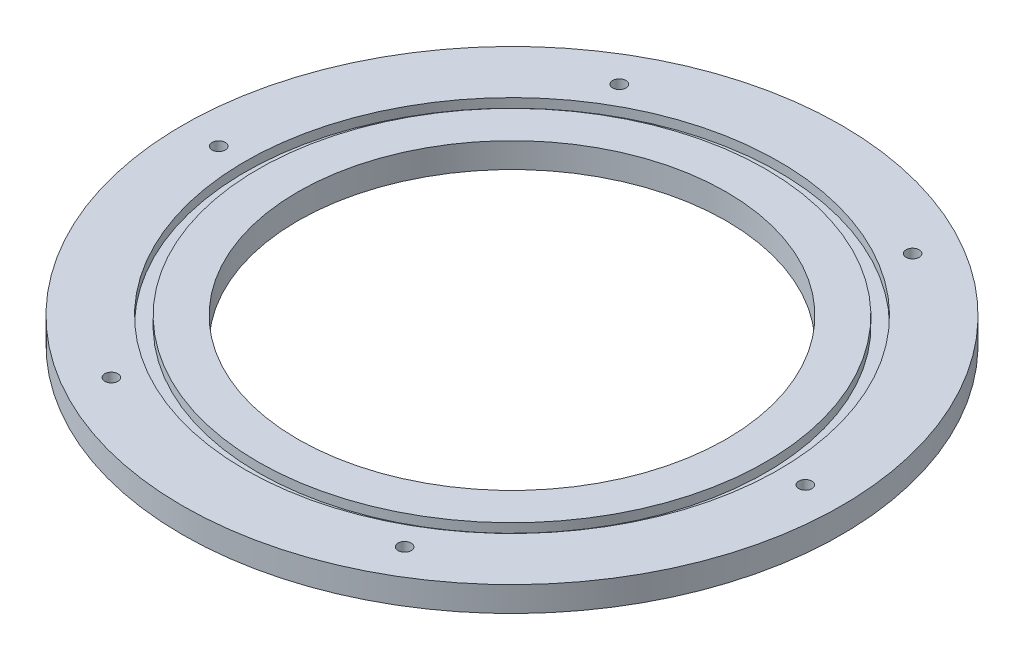
from build123d import *

# Parameters (mm, degrees)
SKETCH1_R           = 250
SKETCH1_R_2         = 162.5
BOSS_EXTRUDE1_DEPTH = 9.5
SKETCH2_R           = 202.5
SKETCH2_R_2         = 192.5
CUT_EXTRUDE1_DEPTH  = 7
SKETCH3_R           = 5
CUT_EXTRUDE2_DEPTH  = 355.063553617


with BuildPart() as part:
    # Sketch1 → Boss-Extrude1 (new, symmetric)
    with BuildSketch(Plane(origin=(0, 0, 0), x_dir=(1, 0, 0), z_dir=(0, 1, 0))):
        with Locations(Location((0, 0, 0), (0, 0, 270))):
            Circle(SKETCH1_R)
        with Locations(Location((0, 0, 0), (0, 0, 270))):
            Circle(SKETCH1_R_2, mode=Mode.SUBTRACT)
    extrude(amount=BOSS_EXTRUDE1_DEPTH, both=True)

    # Sketch2 → Cut-Extrude1 (cut)
    with BuildSketch(Plane(origin=(0, 9.5, 0), x_dir=(1, 0, 0), z_dir=(0, 1, 0))):
        with Locations(Location((0, 0, 0), (0, 0, 270))):
            Circle(SKETCH2_R)
        with Locations(Location((0, 0, 0), (0, 0, 270))):
            Circle(SKETCH2_R_2, mode=Mode.SUBTRACT)
    extrude(amount=-CUT_EXTRUDE1_DEPTH, mode=Mode.SUBTRACT)

    # Sketch3 → Cut-Extrude2 (cut, through all)
    with BuildSketch(Plane(origin=(0, 9.5, 0), x_dir=(1, 0, 0), z_dir=(0, 1, 0))):
        with Locations(Location((111.25, 192.690652342, 0), (0, 0, 270))):
            Circle(SKETCH3_R)
        with Locations(Location((222.5, 0, 0), (0, 0, 270))):
            Circle(SKETCH3_R)
        with Locations(Location((-111.25, 192.690652342, 0), (0, 0, 90))):
            Circle(SKETCH3_R)
        with Locations(Location((-222.5, 0, 0), (0, 0, 90))):
            Circle(SKETCH3_R)
        with Locations(Location((111.25, -192.690652342, 0), (0, 0, 90))):
            Circle(SKETCH3_R)
        with Locations(Location((-111.25, -192.690652342, 0), (0, 0, 270))):
            Circle(SKETCH3_R)
    extrude(amount=-CUT_EXTRUDE2_DEPTH, mode=Mode.SUBTRACT)


solid = part.part
